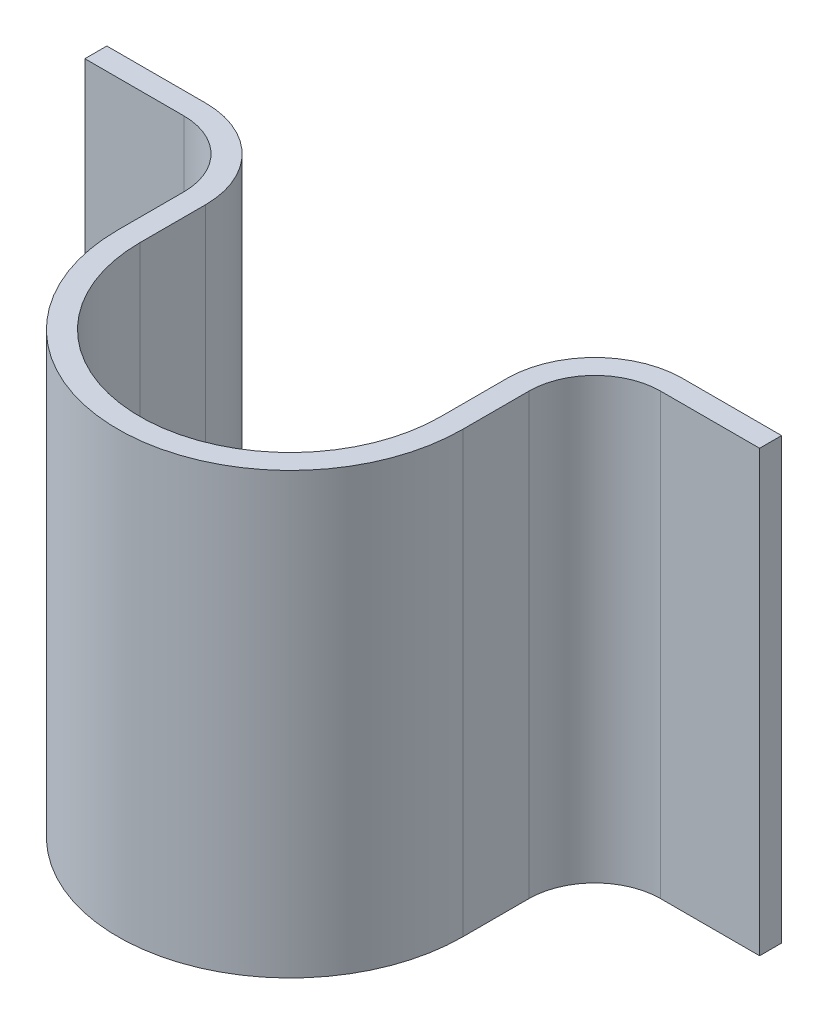
from build123d import *

# Parameters (mm, degrees)
BOSS_EXTRUDE1_DEPTH = 20


with BuildPart() as part:
    # Sketch1 → Boss-Extrude1 (new, symmetric)
    with BuildSketch(Plane(origin=(0, 0, 0), x_dir=(1, 0, 0), z_dir=(0, 1, 0))):
        with BuildLine():
            Line((13.7, 0), (13.7, 6))
            ThreePointArc((13.7, 6), (16.043145751, 11.656854249), (21.7, 14))
            Line((21.7, 14), (30.7, 14))
            Line((30.7, 14), (30.7, 12))
            Line((30.7, 12), (21.7, 12))
            ThreePointArc((21.7, 12), (17.457359313, 10.242640687), (15.7, 6))
            Line((15.7, 6), (15.7, 0))
            ThreePointArc((15.7, 0), (0, -15.7), (-15.7, 0))
            Line((-15.7, 0), (-15.7, 6))
            ThreePointArc((-15.7, 6), (-17.457359313, 10.242640687), (-21.7, 12))
            Line((-21.7, 12), (-30.7, 12))
            Line((-30.7, 12), (-30.7, 14))
            Line((-30.7, 14), (-21.7, 14))
            ThreePointArc((-21.7, 14), (-16.043145751, 11.656854249), (-13.7, 6))
            Line((-13.7, 6), (-13.7, 0))
            ThreePointArc((-13.7, 0), (0, -13.7), (13.7, 0))
        make_face()
    extrude(amount=BOSS_EXTRUDE1_DEPTH, both=True)


solid = part.part
